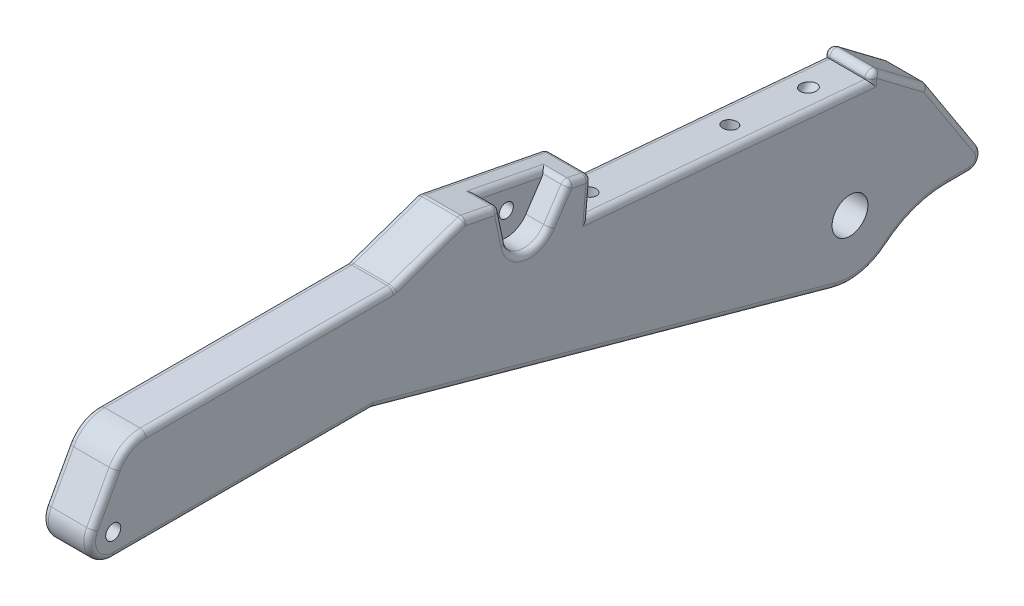
from build123d import *

# Parameters (mm, degrees)
SKETCH1_R           = 2.032
BOSS_EXTRUDE1_DEPTH = 12.7
FILLET1_R           = 9.525
SKETCH2_R           = 4.826
CUT_EXTRUDE1_DEPTH  = 238.90790865
CUT_EXTRUDE6_DEPTH  = 6.35
SKETCH10_R          = 1.905
CUT_EXTRUDE7_DEPTH  = 238.653540891
SKETCH4_R           = 5.715
CUT_EXTRUDE2_DEPTH  = 1.5875
FILLET2_R           = 1.5875
SKETCH6_R           = 1.905
CUT_EXTRUDE3_DEPTH  = 25.4
SKETCH7_R           = 1.905
CUT_EXTRUDE4_DEPTH  = 15.875
SKETCH8_R           = 1.905
CUT_EXTRUDE5_DEPTH  = 12.7


with BuildPart() as part:
    # Sketch1 → Boss-Extrude1 (new body)
    with BuildSketch(Plane(origin=(0, 0, 0), x_dir=(0, 0, -1), z_dir=(1, 0, 0))):
        with BuildLine():
            Line((-5.574599012, 3.040780467), (3.157961292, 19.05))
            Line((3.157961292, 19.05), (75.662744852, 19.05))
            Line((75.662744852, 19.05), (94.776183001, 25.614386431))
            Line((94.776183001, 25.614386431), (129.054233098, 18.923279907))
            Line((129.054233098, 18.923279907), (128.224074649, 9.434525408))
            Line((128.224074649, 9.434525408), (204.134110643, 2.79325781))
            Line((204.134110643, 2.79325781), (204.161005679, 3.100669472))
            ThreePointArc((204.161005679, 3.100669472), (205.09730431, 4.412800765), (206.698779384, 4.229439793))
            Line((206.698779384, 4.229439793), (219.392961654, -5.350975413))
            ThreePointArc((219.392961654, -5.350975413), (219.598467913, -5.536288257), (219.768672831, -5.75447157))
            Line((219.768672831, -5.75447157), (233.444725546, -26.84773219))
            ThreePointArc((233.444725546, -26.84773219), (233.570360338, -30.091006218), (230.780673949, -31.75))
            Line((230.780673949, -31.75), (224.896696771, -31.75))
            ThreePointArc((224.896696771, -31.75), (216.268745771, -33.260285445), (208.666831685, -37.611538462))
            ThreePointArc((208.666831685, -37.611538462), (201.862183679, -40.919877125), (194.299038193, -40.702691568))
            Line((194.299038193, -40.702691568), (69.85, -6.35))
            Line((69.85, -6.35), (0, -6.35))
            ThreePointArc((0, -6.35), (-5.460378007, -3.241415126), (-5.574599012, 3.040780467))
        make_face()
        Circle(SKETCH1_R, mode=Mode.SUBTRACT)
    extrude(amount=BOSS_EXTRUDE1_DEPTH)

    # Fillet1
    fillet1_edges = [part.edges().sort_by_distance(p)[0] for p in [
        (6.35, 19.05, -3.157961292),
    ]]
    fillet(fillet1_edges, radius=FILLET1_R)

    # Sketch2 → Cut-Extrude1 (cut, through all)
    with BuildSketch(Plane.ZY):
        with Locations((-198.523166007, -25.4)):
            Circle(SKETCH2_R)
    extrude(amount=-CUT_EXTRUDE1_DEPTH, mode=Mode.SUBTRACT)

    # Sketch9 → Cut-Extrude6 (cut)
    with BuildSketch(Plane(origin=(12.7, 0, 0), x_dir=(0, 0, -1), z_dir=(1, 0, 0))):
        with BuildLine():
            Line((106.035867409, 14.458235691), (104.124742118, 23.789539197))
            Line((104.124742118, 23.789539197), (122.821860353, 20.13984473))
            Line((122.821860353, 20.13984473), (117.541786323, 12.212269865))
            ThreePointArc((117.541786323, 12.212269865), (111.040171591, 9.499946473), (106.035867409, 14.458235691))
        make_face()
    extrude(amount=-CUT_EXTRUDE6_DEPTH, mode=Mode.SUBTRACT)

    # Sketch10 → Cut-Extrude7 (cut, through all)
    with BuildSketch(Plane(origin=(6.35, 0, 0), x_dir=(0, 0, -1), z_dir=(1, 0, 0))):
        with Locations((112.256736413, 15.732319218)):
            Circle(SKETCH10_R)
    extrude(amount=-CUT_EXTRUDE7_DEPTH, mode=Mode.SUBTRACT)

    # Sketch4 → Cut-Extrude2 (cut)
    with BuildSketch(Plane(origin=(0, 0, 0), x_dir=(0, 0, -1), z_dir=(1, 0, 0))):
        with Locations((198.523166007, -25.4)):
            Circle(SKETCH4_R)
    extrude(amount=CUT_EXTRUDE2_DEPTH, mode=Mode.SUBTRACT)

    # Fillet2
    fillet2_edges = [part.edges().sort_by_distance(p)[0] for p in [
        (12.7, -23.526345784, -132.074519097),
        (12.7, -40.919877125, -201.862183679),
        (0, 19.05, -42.237490592),
        (0, 22.332193215, -85.219463927),
        (0, 22.268833169, -111.91520805),
        (0, 14.178902657, -128.639153874),
        (0, 6.113891609, -166.179092646),
        (0, 2.946963641, -204.147558161),
        (0, 4.412800765, -205.09730431),
        (0, -0.56076781, -213.045870519),
        (12.7, -33.260285445, -216.268745771),
        (0, -5.536288257, -219.598467913),
        (0, -16.30110188, -226.606699189),
        (0, -30.091006218, -233.570360338),
        (0, -31.75, -227.83868536),
        (0, -33.260285445, -216.268745771),
        (0, -40.919877125, -201.862183679),
        (0, -23.526345784, -132.074519097),
        (0, -6.35, -34.925),
        (0, -3.241415126, 5.460378007),
        (12.7, -31.75, -227.83868536),
        (12.7, -30.091006218, -233.570360338),
        (6.35, 19.05, -75.662744852),
        (6.35, 25.614386431, -94.776183001),
        (6.35, 18.923279907, -129.054233098),
        (12.7, -16.30110188, -226.606699189),
        (12.7, -5.536288257, -219.598467913),
        (12.7, -0.56076781, -213.045870519),
        (12.7, 4.412800765, -205.09730431),
        (12.7, 2.946963641, -204.147558161),
        (12.7, -3.241415126, 5.460378007),
        (12.7, 6.113891609, -166.179092646),
        (0, 8.563475584, 2.5621306),
        (12.7, 8.563475584, 2.5621306),
        (12.7, 14.178902657, -128.639153874),
        (0, 17.715567011, -3.950113643),
        (12.7, 17.715567011, -3.950113643),
        (12.7, 19.531562318, -125.938046726),
        (12.7, 22.332193215, -85.219463927),
        (12.7, 19.05, -42.237490592),
        (12.7, 24.701962814, -99.45046256),
        (6.35, 21.964691963, -113.473301236),
        (9.525, 23.789539197, -104.124742118),
        (9.525, 20.13984473, -122.821860353),
        (12.7, 9.499946473, -111.040171591),
        (12.7, 16.176057297, -120.181823338),
        (12.7, 19.123887444, -105.080304764),
        (12.7, -6.35, -34.925),
    ]]
    fillet(fillet2_edges, radius=FILLET2_R)

    # Sketch6 → Cut-Extrude3 (cut)
    with BuildSketch(Plane(origin=(0, 102.082274381, -77.04242407), x_dir=(1, 0, 0), z_dir=(0, 0.798192165141452, -0.6024029112701905))):
        with Locations(Location((6.35, 152.364748226, 0), (0, 0, 270))):
            Circle(SKETCH6_R)
    extrude(amount=-CUT_EXTRUDE3_DEPTH, mode=Mode.SUBTRACT)

    # Sketch7 → Cut-Extrude4 (cut)
    with BuildSketch(Plane(origin=(0, 20.495798036, -1.793149978), x_dir=(1, 0, 0), z_dir=(0, 0.996194698091746, -0.0871557427476538))):
        with Locations(Location((6.35, 171.363870263, 0), (0, 0, 270))):
            Circle(SKETCH7_R)
        with Locations(Location((6.35, 133.263870263, 0), (0, 0, 270))):
            Circle(SKETCH7_R)
    extrude(amount=-CUT_EXTRUDE4_DEPTH, mode=Mode.SUBTRACT)

    # Sketch8 → Cut-Extrude5 (cut)
    with BuildSketch(Plane(origin=(0, 98.615320401, -152.099344577), x_dir=(-1, 0, 0), z_dir=(0, 0.5440213575001199, -0.839071369183651))):
        with Locations(Location((-6.35, -139.982344987, 0), (0, 0, 90))):
            Circle(SKETCH8_R)
    extrude(amount=-CUT_EXTRUDE5_DEPTH, mode=Mode.SUBTRACT)


solid = part.part
